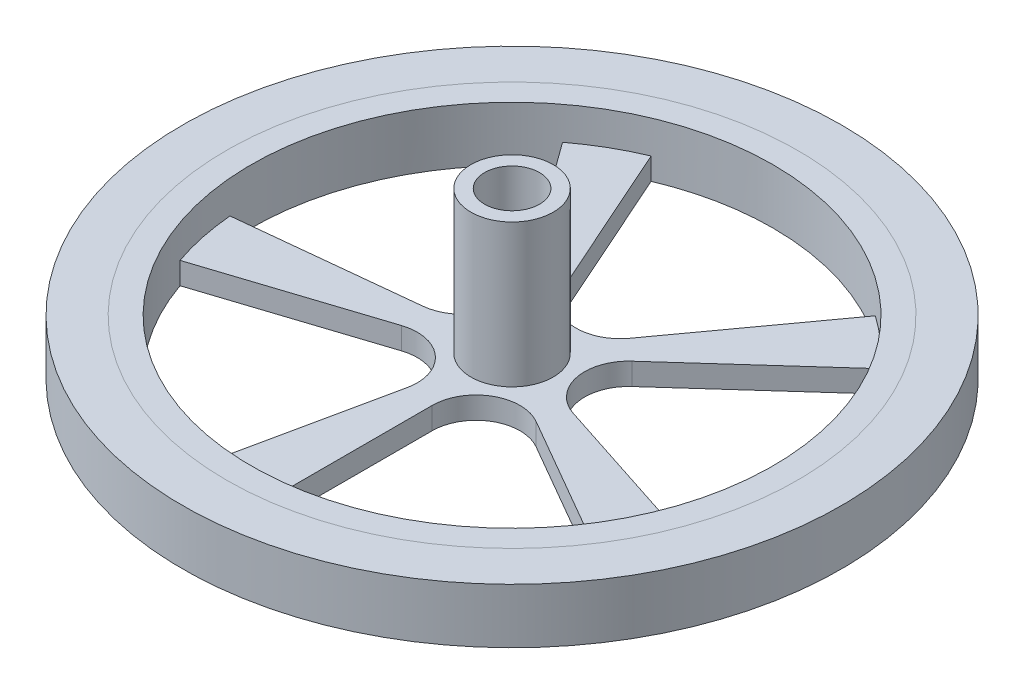
from build123d import *

# Parameters (mm, degrees)
CUT_EXTRUDE1_DEPTH = 58.15
CIRPATTERN1_COUNT  = 5


with BuildPart() as part:
    # Sketch1 → Revolve1 (revolve)
    with BuildSketch(Plane.XY):
        Polygon((38.1, 6.35), (38.1, 0), (0, 0), (0, 6.35), (3.175, 6.35), (3.175, 19.05), (4.7625, 19.05), (4.7625, 2.54), (30.1625, 2.54), (30.1625, 6.35), align=None)
    revolve(axis=Axis((0, 0, 0), (0, 1, 0)))

    # Sketch2 → Cut-Extrude1 (cut, through all)
    with BuildSketch(Plane.XZ):
        with BuildLine():
            Line((0.599134, 30.156549), (0.599134, 9.836549))
            ThreePointArc((0.599134, 9.836549), (3.139134, 5.43714), (8.219134, 5.43714))
            Line((8.219134, 5.43714), (25.81677, 15.59714))
            ThreePointArc((25.81677, 15.59714), (15.08125, 26.121491), (0.599134, 30.156549))
        make_face()
    cut_extrude1 = extrude(amount=-CUT_EXTRUDE1_DEPTH, mode=Mode.SUBTRACT)

    # CirPattern1: Cut-Extrude1 ×5 about axis
    cirpattern1_axis = Axis((0, -1.42875, 0), (0, 1, 0))
    for i in range(1, CIRPATTERN1_COUNT):
        add(cut_extrude1.rotate(cirpattern1_axis, i * 360 / CIRPATTERN1_COUNT), mode=Mode.SUBTRACT)


solid = part.part
